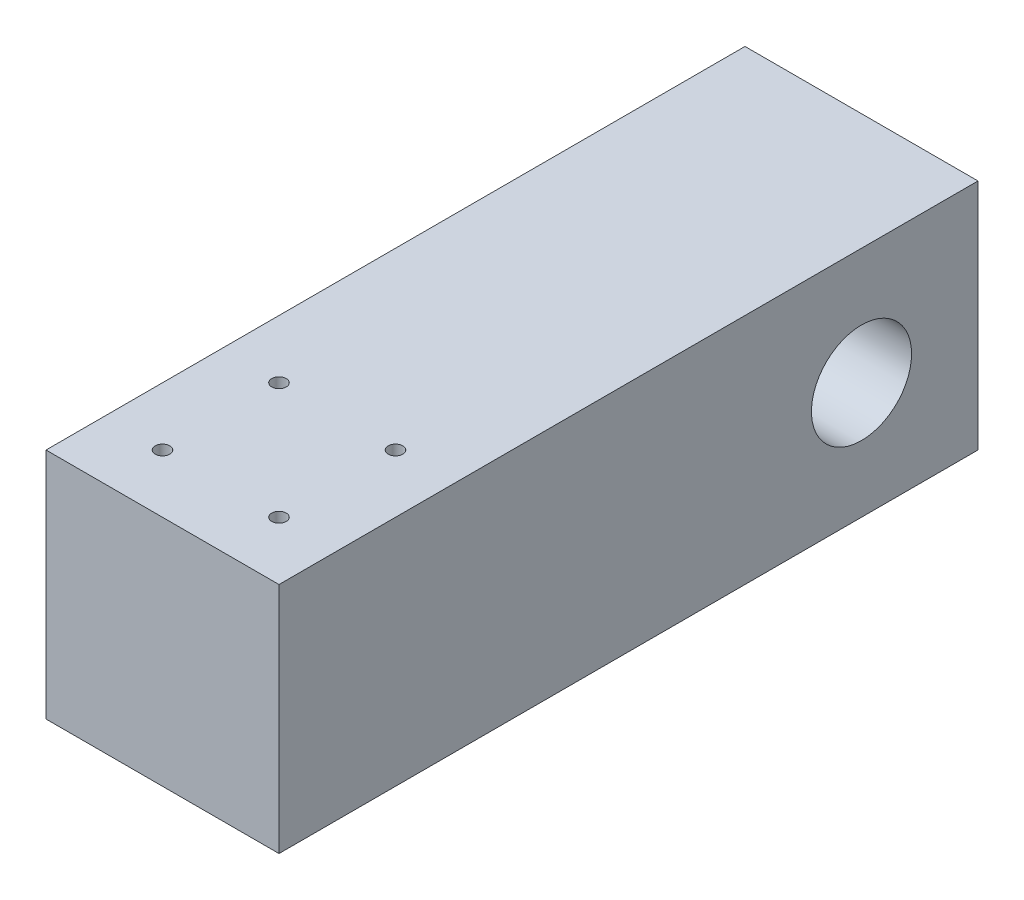
from build123d import *

# Parameters (mm, degrees)
SKETCH1_W           = 152.4
SKETCH1_H           = 50.8
BOSS_EXTRUDE1_DEPTH = 50.8
SKETCH2_R           = 10.9140625
CUT_EXTRUDE1_DEPTH  = 169.48453935
SKETCH3_R           = 1.5875
CUT_EXTRUDE2_DEPTH  = 169.48453935


with BuildPart() as part:
    # Sketch1 → Boss-Extrude1 (new body)
    with BuildSketch(Plane(origin=(0, 0, 0), x_dir=(0, 0, -1), z_dir=(1, 0, 0))):
        with Locations((76.2, 25.4)):
            Rectangle(SKETCH1_W, SKETCH1_H)
    extrude(amount=BOSS_EXTRUDE1_DEPTH)

    # Sketch2 → Cut-Extrude1 (cut, through all)
    with BuildSketch(Plane(origin=(50.8, 0, 0), x_dir=(0, 0, -1), z_dir=(1, 0, 0))):
        with Locations((127, 25.4)):
            Circle(SKETCH2_R)
    extrude(amount=-CUT_EXTRUDE1_DEPTH, mode=Mode.SUBTRACT)

    # Sketch3 → Cut-Extrude2 (cut, through all)
    with BuildSketch(Plane(origin=(0, 50.8, 0), x_dir=(1, 0, 0), z_dir=(0, 1, 0))):
        with Locations(Location((12.7, 38.1, 0), (0, 0, 270))):
            Circle(SKETCH3_R)
        with Locations(Location((38.1, 38.1, 0), (0, 0, 270))):
            Circle(SKETCH3_R)
        with Locations(Location((12.7, 12.7, 0), (0, 0, 270))):
            Circle(SKETCH3_R)
        with Locations(Location((38.1, 12.7, 0), (0, 0, 270))):
            Circle(SKETCH3_R)
    extrude(amount=-CUT_EXTRUDE2_DEPTH, mode=Mode.SUBTRACT)


solid = part.part
